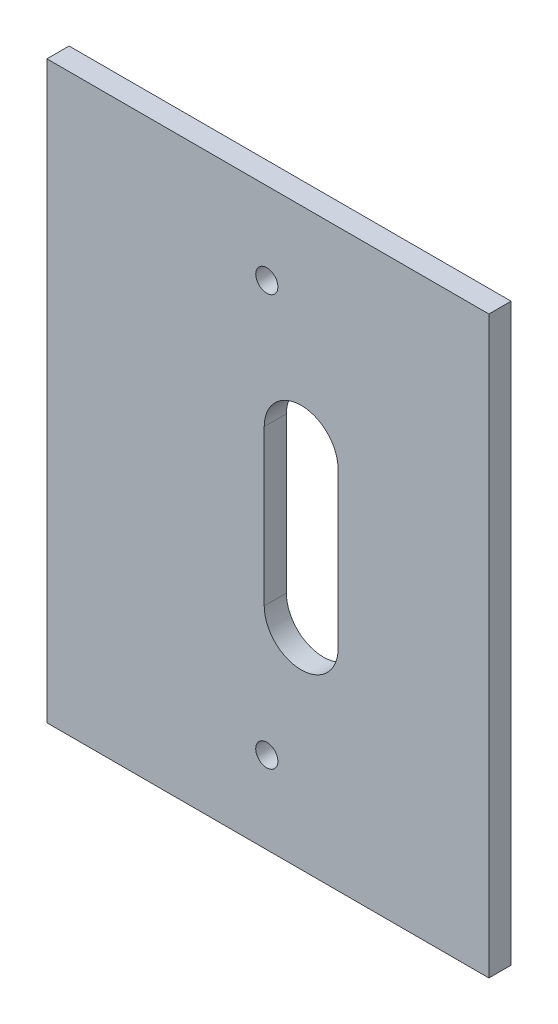
from build123d import *

# Parameters (mm, degrees)
SKETCH1_W           = 59.8
SKETCH1_H           = 77.8
BOSS_EXTRUDE1_DEPTH = 3
SKETCH2_R           = 1.5
CUT_EXTRUDE1_DEPTH  = 50.155060777


with BuildPart() as part:
    # Sketch1 → Boss-Extrude1 (new body)
    with BuildSketch(Plane.XY):
        Rectangle(SKETCH1_W, SKETCH1_H)
    extrude(amount=BOSS_EXTRUDE1_DEPTH)

    # Sketch2 → Cut-Extrude1 (cut, through all)
    with BuildSketch(Plane(origin=(0, 0, 0), x_dir=(-1, 0, 0), z_dir=(0, 0, -1))):
        with Locations((0.15, -27.8)):
            Circle(SKETCH2_R)
        with Locations((0.15, 27.8)):
            Circle(SKETCH2_R)
        with BuildLine():
            Line((0.5, -10.5), (0.5, 10.5))
            ThreePointArc((0.5, 10.5), (-4.5, 15.5), (-9.5, 10.5))
            Line((-9.5, 10.5), (-9.5, -10.5))
            ThreePointArc((-9.5, -10.5), (-4.5, -15.5), (0.5, -10.5))
        make_face()
    extrude(amount=-CUT_EXTRUDE1_DEPTH, mode=Mode.SUBTRACT)


solid = part.part
